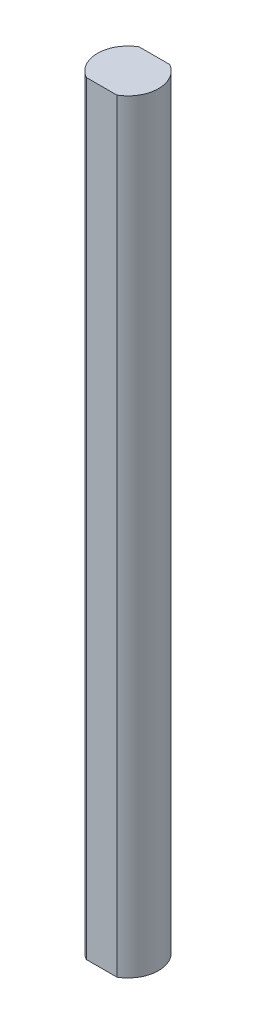
from build123d import *

# Parameters (mm, degrees)
BOSS_EXTRUDE1_DEPTH = 50


with BuildPart() as part:
    # Sketch2 → Boss-Extrude1 (new, symmetric)
    with BuildSketch(Plane(origin=(0, 0, 0), x_dir=(1, 0, 0), z_dir=(0, 1, 0))):
        with BuildLine():
            Line((-2, -3.464101615), (2, -3.464101615))
            ThreePointArc((2, -3.464101615), (4, 0), (2, 3.464101615))
            Line((2, 3.464101615), (-2, 3.464101615))
            ThreePointArc((-2, 3.464101615), (-4, 0), (-2, -3.464101615))
        make_face()
    extrude(amount=BOSS_EXTRUDE1_DEPTH, both=True)


solid = part.part
